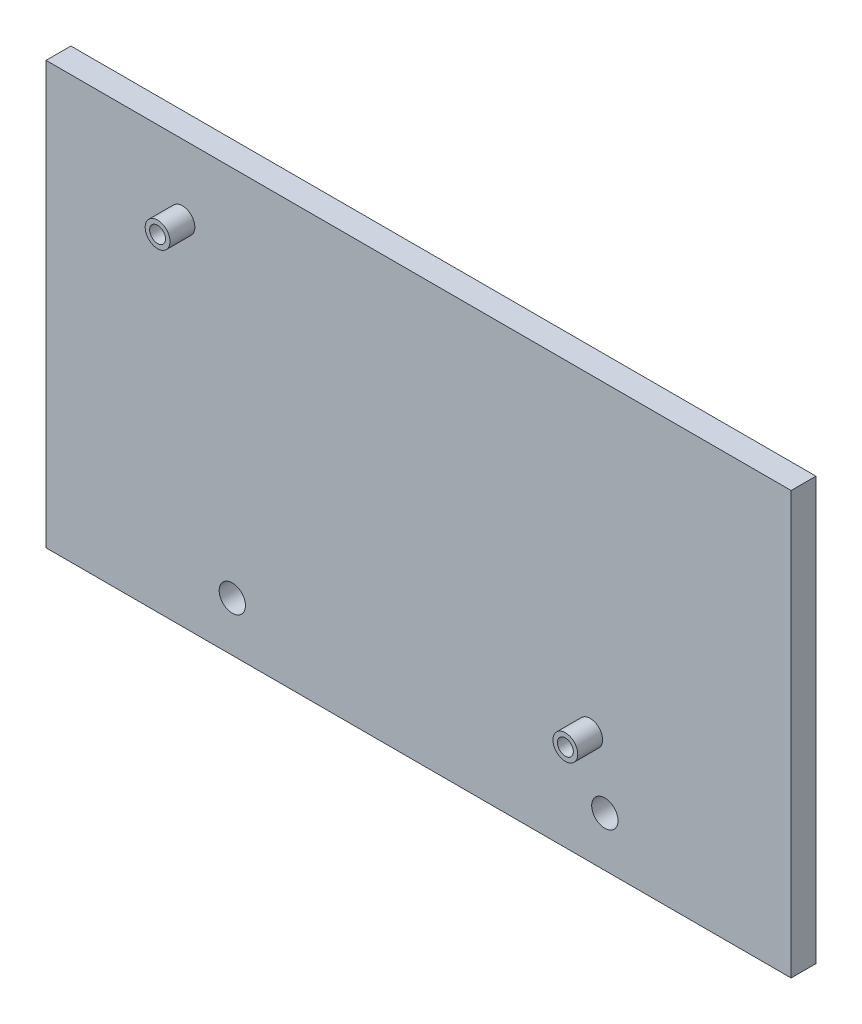
from build123d import *

# Parameters (mm, degrees)
SKETCH1_W           = 150
SKETCH1_H           = 85
SKETCH1_R           = 2.65
BOSS_EXTRUDE1_DEPTH = 5
CUT_EXTRUDE1_DEPTH  = 5
BOSS_EXTRUDE2_START = 5
SKETCH3_R           = 2.5
SKETCH3_R_2         = 1.6
BOSS_EXTRUDE2_DEPTH = 5
SKETCH4_R           = 3
CUT_EXTRUDE2_DEPTH  = 3.2


with BuildPart() as part:
    # Sketch1 → Boss-Extrude1 (new body)
    with BuildSketch(Plane.XY):
        with Locations((75, 42.5)):
            Rectangle(SKETCH1_W, SKETCH1_H)
        with Locations((37.5, 10)):
            Circle(SKETCH1_R, mode=Mode.SUBTRACT)
        with Locations((112.5, 10)):
            Circle(SKETCH1_R, mode=Mode.SUBTRACT)
    extrude(amount=BOSS_EXTRUDE1_DEPTH)

    # Sketch2 → Cut-Extrude1 (cut)
    with BuildSketch(Plane.XY.offset(5)):
        with BuildLine():
            Line((27.4544, 72.4762), (27.4544, 70.8762))
            Line((27.4544, 70.8762), (25.8544, 70.8762))
            ThreePointArc((25.8544, 70.8762), (27.4544, 69.2762), (29.0544, 70.8762))
            ThreePointArc((29.0544, 70.8762), (28.58577085, 72.00757085), (27.4544, 72.4762))
        make_face()
        with BuildLine():
            Line((25.8544, 70.8762), (27.4544, 70.8762))
            Line((27.4544, 70.8762), (27.4544, 72.4762))
            ThreePointArc((27.4544, 72.4762), (26.32302915, 72.00757085), (25.8544, 70.8762))
        make_face()
        with BuildLine():
            Line((27.4544, 72.4762), (27.4544, 70.8762))
            Line((27.4544, 70.8762), (25.8544, 70.8762))
            ThreePointArc((25.8544, 70.8762), (27.4544, 69.2762), (29.0544, 70.8762))
            ThreePointArc((29.0544, 70.8762), (28.58577085, 72.00757085), (27.4544, 72.4762))
        make_face()
        with BuildLine():
            Line((25.8544, 70.8762), (27.4544, 70.8762))
            Line((27.4544, 70.8762), (27.4544, 72.4762))
            ThreePointArc((27.4544, 72.4762), (26.32302915, 72.00757085), (25.8544, 70.8762))
        make_face()
        with BuildLine():
            ThreePointArc((111.149409347, 22.54), (108.418038497, 23.67137085), (109.549409347, 20.94))
            Line((109.549409347, 20.94), (109.549409347, 22.54))
            Line((109.549409347, 22.54), (111.149409347, 22.54))
        make_face()
        with BuildLine():
            Line((109.549409347, 22.54), (109.549409347, 20.94))
            ThreePointArc((109.549409347, 20.94), (110.680780197, 21.40862915), (111.149409347, 22.54))
            Line((111.149409347, 22.54), (109.549409347, 22.54))
        make_face()
        with BuildLine():
            ThreePointArc((111.149409347, 22.54), (108.418038497, 23.67137085), (109.549409347, 20.94))
            Line((109.549409347, 20.94), (109.549409347, 22.54))
            Line((109.549409347, 22.54), (111.149409347, 22.54))
        make_face()
        with BuildLine():
            Line((109.549409347, 22.54), (109.549409347, 20.94))
            ThreePointArc((109.549409347, 20.94), (110.680780197, 21.40862915), (111.149409347, 22.54))
            Line((111.149409347, 22.54), (109.549409347, 22.54))
        make_face()
    extrude(amount=-CUT_EXTRUDE1_DEPTH, mode=Mode.SUBTRACT)

    # Sketch3 → Boss-Extrude2 (add)
    # profile 1 of 2: a face of its own
    with BuildSketch(Plane.XY.offset(5).offset(BOSS_EXTRUDE2_START)):
        with Locations((27.4544, 70.8762)):
            Circle(SKETCH3_R)
        with Locations((27.4544, 70.8762)):
            Circle(SKETCH3_R_2, mode=Mode.SUBTRACT)
    # profile 2 of 2: a face of its own
    with BuildSketch(Plane.XY.offset(5).offset(BOSS_EXTRUDE2_START)):
        with Locations((109.549409347, 22.54)):
            Circle(SKETCH3_R)
        with Locations((109.549409347, 22.54)):
            Circle(SKETCH3_R_2, mode=Mode.SUBTRACT)
    extrude(amount=-BOSS_EXTRUDE2_DEPTH)

    # Sketch4 → Cut-Extrude2 (cut)
    with BuildSketch(Plane(origin=(0, 0, 0), x_dir=(-1, 0, 0), z_dir=(0, 0, -1))):
        with Locations((-27.4544, 70.8762)):
            Circle(SKETCH4_R)
        with Locations((-109.549409347, 22.54)):
            Circle(SKETCH4_R)
    extrude(amount=-CUT_EXTRUDE2_DEPTH, mode=Mode.SUBTRACT)


solid = part.part
